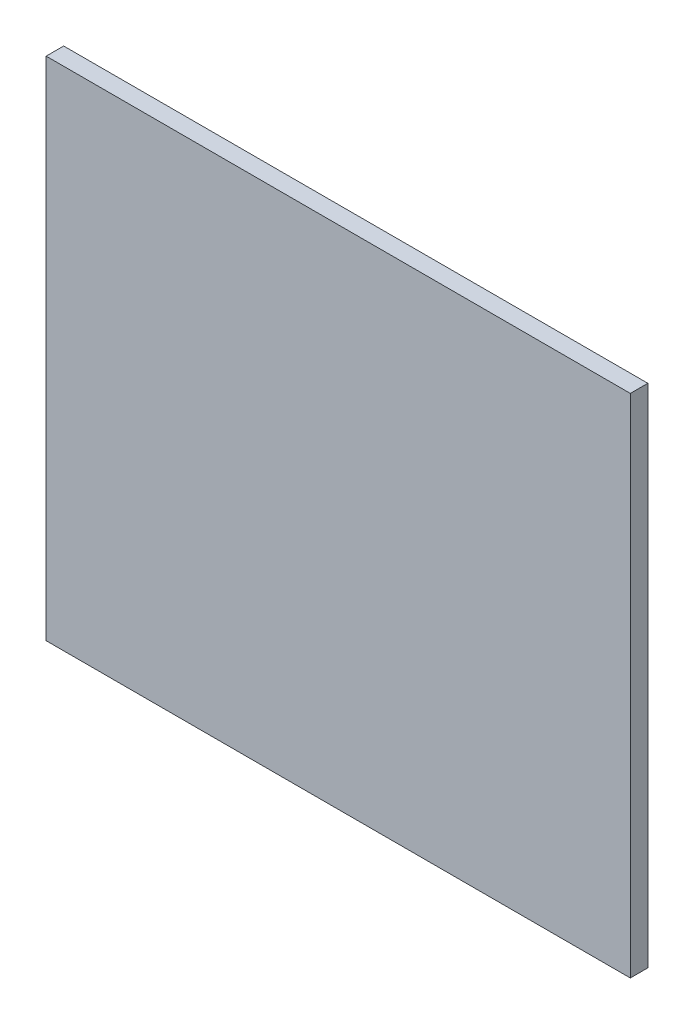
from build123d import *

# Parameters (mm, degrees)
SKETCH1_W           = 150
SKETCH1_H           = 130
BOSS_EXTRUDE1_DEPTH = 4.5


with BuildPart() as part:
    # Sketch1 → Boss-Extrude1 (new body)
    with BuildSketch(Plane.XY):
        Rectangle(SKETCH1_W, SKETCH1_H)
    extrude(amount=BOSS_EXTRUDE1_DEPTH)


solid = part.part
